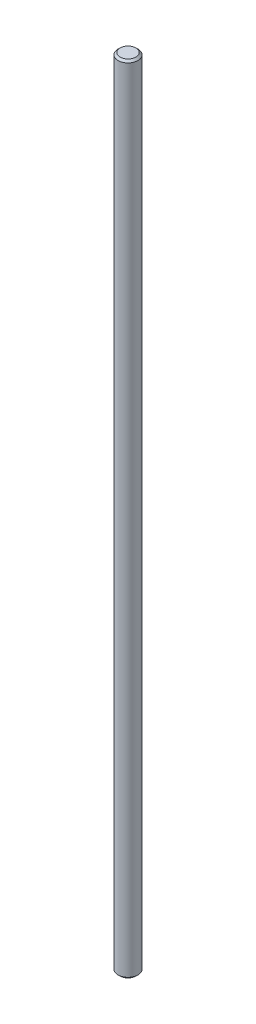
from build123d import *

# Parameters (mm, degrees)
SKETCH1_R           = 4
BOSS_EXTRUDE1_DEPTH = 320
CHAMFER1_SIZE       = 0.8


with BuildPart() as part:
    # Sketch1 → Boss-Extrude1 (new body)
    with BuildSketch(Plane(origin=(0, 0, 0), x_dir=(1, 0, 0), z_dir=(0, 1, 0))):
        with Locations(Location((0, 0, 0), (0, 0, 270))):
            Circle(SKETCH1_R)
    extrude(amount=BOSS_EXTRUDE1_DEPTH)

    # Chamfer1
    chamfer1_edges = [part.edges().sort_by_distance(p)[0] for p in [
        (0, 0, -4),
        (0, 320, -4),
    ]]
    chamfer(chamfer1_edges, length=CHAMFER1_SIZE)


solid = part.part
